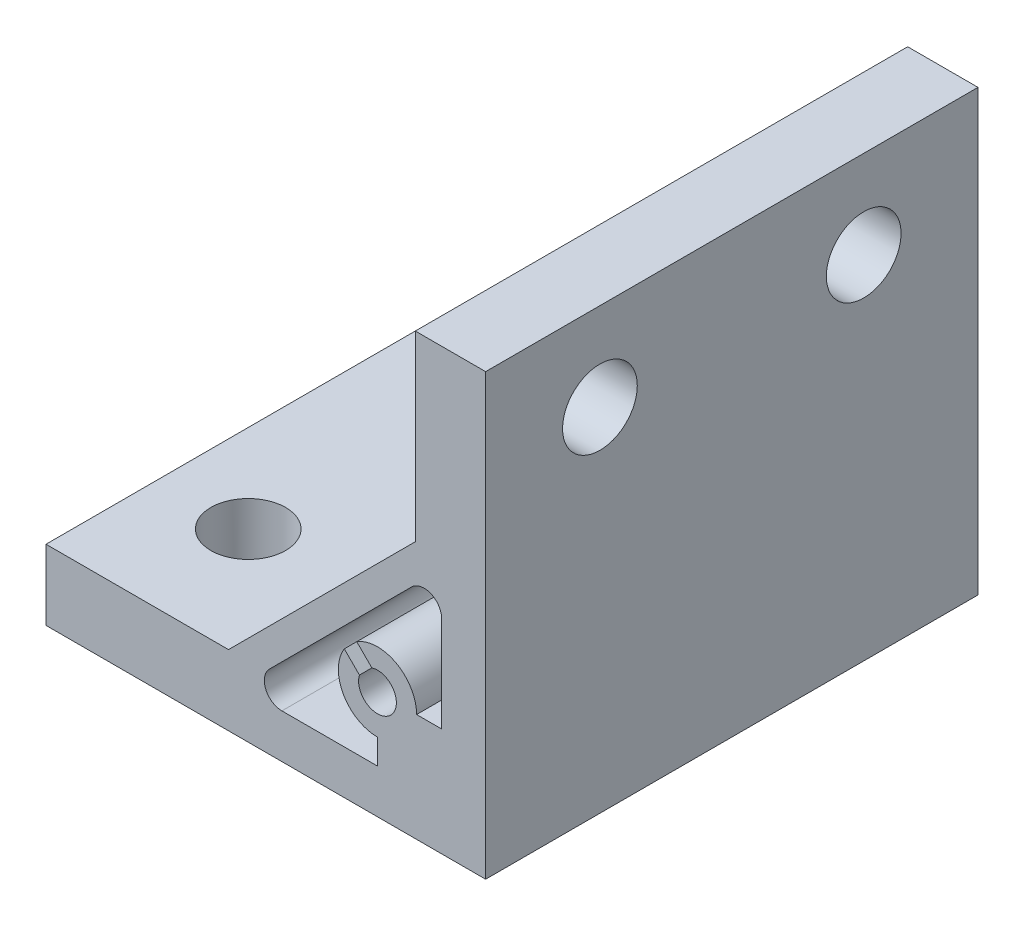
from build123d import *

# Parameters (mm, degrees)
EXTRUDE_1_DEPTH     = 28
SKETCH_3_R          = 4.25
CUT_EXTRUDE_1_DEPTH = 56


with BuildPart() as part:
    # 草图1 → 凸台-拉伸1 (new, symmetric)
    with BuildSketch(Plane.XY):
        Polygon((0, 0), (50, 0), (50, 50), (42, 50), (42, 29.242640687), (20.757359313, 8), (0, 8), align=None)
        with BuildLine():
            Line((37.061279898, 14.352933665), (35.340960992, 16.07325257))
            ThreePointArc((35.340960992, 16.07325257), (39.856939547, 16.192314452), (42.15, 12.3))
            Line((42.15, 12.3), (45, 12.3))
            Line((45, 12.3), (45, 23.171572875))
            ThreePointArc((45, 23.171572875), (43.765366865, 25.01933194), (41.585786438, 24.585786438))
            Line((41.585786438, 24.585786438), (25.414213562, 8.414213562))
            ThreePointArc((25.414213562, 8.414213562), (24.98066806, 6.234633135), (26.828427125, 5))
            Line((26.828427125, 5), (37.7, 5))
            Line((37.7, 5), (37.7, 7.85))
            ThreePointArc((37.7, 7.85), (33.807685548, 10.143060453), (33.92674743, 14.659039008))
            Line((33.92674743, 14.659039008), (35.647066335, 12.938720102))
            ThreePointArc((35.647066335, 12.938720102), (39.22027958, 10.77972042), (37.061279898, 14.352933665))
        make_face(mode=Mode.SUBTRACT)
    extrude(amount=EXTRUDE_1_DEPTH, both=True)

    # 草图3 → 切除-拉伸1 (cut)
    with BuildSketch(Plane(origin=(0, 8, 0), x_dir=(1, 0, 0), z_dir=(0, 1, 0))):
        with Locations(Location((10, 15, 0), (0, 0, 270))):
            Circle(SKETCH_3_R)
        with Locations(Location((10, -15, 0), (0, 0, 270))):
            Circle(SKETCH_3_R)
    cut_extrude_1 = extrude(amount=-CUT_EXTRUDE_1_DEPTH, mode=Mode.SUBTRACT)

    # 镜向1: 切除-拉伸1 across plane
    add(cut_extrude_1.mirror(Plane(origin=(25, 25, 0), x_dir=(0, 0, 1), z_dir=(-0.7071067811865486, -0.7071067811865465, 0))), mode=Mode.SUBTRACT)


solid = part.part
